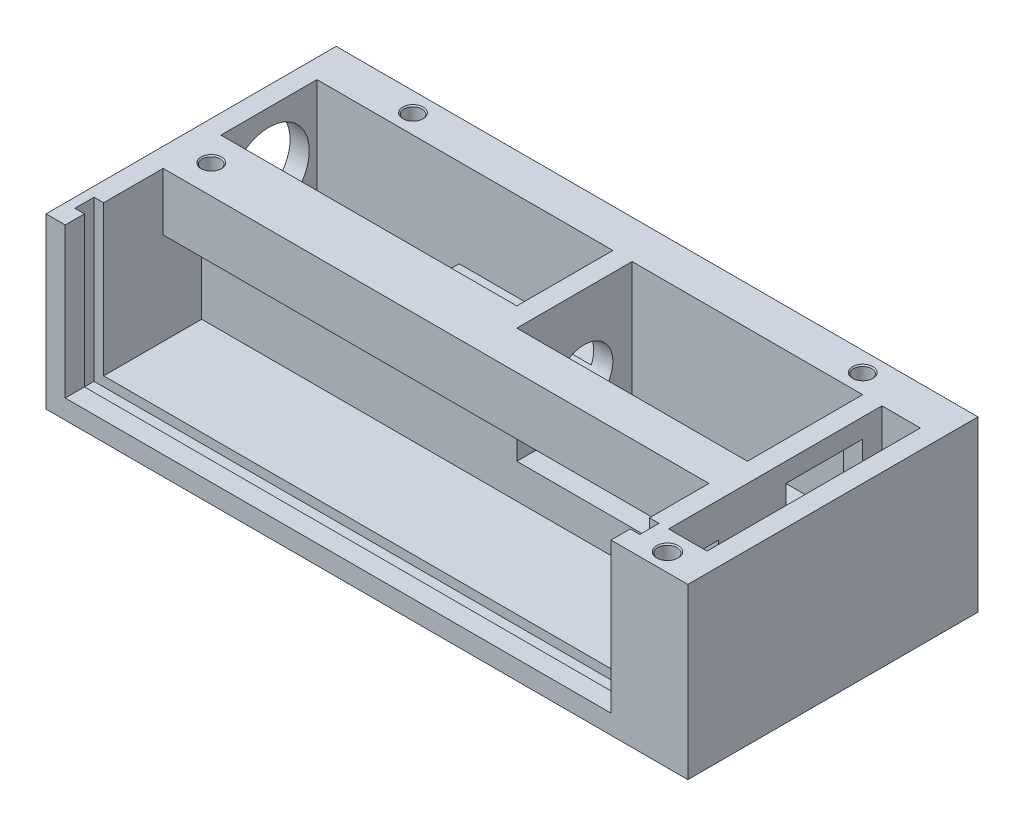
from build123d import *
from build123d.topology import SkipClean

# Parameters (mm, degrees)
SKETCH1_W           = 152
SKETCH1_H           = 65.5
BOSS_EXTRUDE1_DEPTH = 44
SKETCH2_W           = 142
SKETCH2_H           = 25.5
CUT_EXTRUDE1_DEPTH  = 39
SKETCH4_W           = 60
SKETCH4_H           = 30
CUT_EXTRUDE2_DEPTH  = 30
BOSS_EXTRUDE3_REACH = 158.9
SKETCH5_W           = 10
SKETCH5_H           = 15
SKETCH9_W           = 152
SKETCH9_H           = 44
BOSS_EXTRUDE4_DEPTH = 10
CUT_EXTRUDE5_DEPTH  = 41.5
SKETCH11_W          = 142
SKETCH11_H          = 39
CUT_EXTRUDE6_DEPTH  = 5
SKETCH16_W          = 77
SKETCH16_H          = 25
CUT_EXTRUDE8_DEPTH  = 39
SKETCH17_R          = 10.5
CUT_EXTRUDE9_DEPTH  = 5
SKETCH18_R          = 7.5
CUT_EXTRUDE10_DEPTH = 5
SKETCH20_W          = 75.5
SKETCH20_H          = 44
BOSS_EXTRUDE6_DEPTH = 15
SKETCH21_W          = 10
SKETCH21_H          = 55.5
CUT_EXTRUDE12_DEPTH = 39
SKETCH22_W          = 20
SKETCH22_H          = 20
SKETCH22_W_2        = 7.5
SKETCH22_H_2        = 25
CUT_EXTRUDE13_DEPTH = 5
CUT_EXTRUDE14_DEPTH = 3.5
SKETCH24_W          = 5
SKETCH24_H          = 6.5
BOSS_EXTRUDE7_DEPTH = 5
SKETCH24_3_W        = 3
SKETCH24_3_H        = 12
BOSS_EXTRUDE8_DEPTH = 2.5
CUT_EXTRUDE7_DEPTH  = 6
BOSS_EXTRUDE5_DEPTH = 3
SKETCH19_R          = 2.35
SKETCH19_R_2        = 2.5
CUT_EXTRUDE11_DEPTH = 6
BOSS_EXTRUDE9_DEPTH = 40
CHAMFER1_SIZE       = 0.3


with BuildPart() as part:
    # Sketch1 → Boss-Extrude1 (new body)
    with BuildSketch(Plane(origin=(0, 0, 0), x_dir=(1, 0, 0), z_dir=(0, 1, 0))):
        Rectangle(SKETCH1_W, SKETCH1_H)
    extrude(amount=BOSS_EXTRUDE1_DEPTH)

    # Sketch2 → Cut-Extrude1 (cut)
    with BuildSketch(Plane(origin=(0, 44, 0), x_dir=(1, 0, 0), z_dir=(0, 1, 0))):
        with Locations((0, -20)):
            Rectangle(SKETCH2_W, SKETCH2_H)
    extrude(amount=-CUT_EXTRUDE1_DEPTH, mode=Mode.SUBTRACT)

    # Sketch4 → Cut-Extrude2 (cut)
    with BuildSketch(Plane(origin=(0, 44, 0), x_dir=(1, 0, 0), z_dir=(0, 1, 0))):
        with Locations((41, 7.75)):
            Rectangle(SKETCH4_W, SKETCH4_H)
    extrude(amount=-CUT_EXTRUDE2_DEPTH, mode=Mode.SUBTRACT)

    # Boss-Extrude3: up to this face of the body (flat: up to its plane)
    boss_extrude3_end = Plane(part.part.faces().sort_by_distance((71, 26.637767221, 6.817102138))[0])
    # Sketch5 → Boss-Extrude3 (add, up to the picked face)
    with BuildSketch(Plane(origin=(-71, 0, 0), x_dir=(0, 0, -1), z_dir=(1, 0, 0)), mode=Mode.PRIVATE) as boss_extrude3_sk1:
        with Locations((-12.25, 36.5)):
            Rectangle(SKETCH5_W, SKETCH5_H)
    boss_extrude3_tool1 = split(extrude(boss_extrude3_sk1.sketch, amount=BOSS_EXTRUDE3_REACH, mode=Mode.PRIVATE), bisect_by=boss_extrude3_end, keep=Keep.BOTH, mode=Mode.PRIVATE)
    add(boss_extrude3_tool1.solids().sort_by(Axis((-71, 36.5, 12.25), (1, 0, 0)))[0])

    # Sketch9 → Boss-Extrude4 (add)
    with BuildSketch(Plane.XY.offset(32.75)):
        with Locations((0, 22)):
            Rectangle(SKETCH9_W, SKETCH9_H)
    extrude(amount=BOSS_EXTRUDE4_DEPTH)

    # Sketch10 → Cut-Extrude5 (cut)
    with BuildSketch(Plane(origin=(0, 44, 0), x_dir=(1, 0, 0), z_dir=(0, 1, 0))):
        Polygon((-73.5, -32.75), (-73.5, -37.75), (73.5, -37.75), (73.5, -32.75), (71, -32.75), (-71, -32.75), align=None)
    extrude(amount=-CUT_EXTRUDE5_DEPTH, mode=Mode.SUBTRACT)

    # Sketch11 → Cut-Extrude6 (cut)
    with BuildSketch(Plane.XY.offset(42.75)):
        with Locations((0, 24.5)):
            Rectangle(SKETCH11_W, SKETCH11_H)
    extrude(amount=-CUT_EXTRUDE6_DEPTH, mode=Mode.SUBTRACT)

    # Sketch16 → Cut-Extrude8 (cut)
    with BuildSketch(Plane(origin=(0, 44, 0), x_dir=(1, 0, 0), z_dir=(0, 1, 0))):
        with Locations((-32.5, 10.25)):
            Rectangle(SKETCH16_W, SKETCH16_H)
    extrude(amount=-CUT_EXTRUDE8_DEPTH, mode=Mode.SUBTRACT)

    # Sketch17 → Cut-Extrude9 (cut)
    with BuildSketch(Plane(origin=(-71, 0, 0), x_dir=(0, 0, -1), z_dir=(1, 0, 0))):
        with Locations((10.25, 29)):
            Circle(SKETCH17_R)
        with BuildLine():
            Line((7.5, 12), (13, 12))
            ThreePointArc((13, 12), (15, 10), (13, 8))
            Line((13, 8), (7.5, 8))
            ThreePointArc((7.5, 8), (5.5, 10), (7.5, 12))
        make_face()
    extrude(amount=-CUT_EXTRUDE9_DEPTH, mode=Mode.SUBTRACT)

    # Sketch18 → Cut-Extrude10 (cut)
    with BuildSketch(Plane(origin=(11, 0, 0), x_dir=(0, 0, -1), z_dir=(1, 0, 0))):
        with Locations((10.25, 24)):
            Circle(SKETCH18_R)
    extrude(amount=-CUT_EXTRUDE10_DEPTH, mode=Mode.SUBTRACT)

    # Sketch20 → Boss-Extrude6 (add)
    with BuildSketch(Plane(origin=(76, 0, 0), x_dir=(0, 0, -1), z_dir=(1, 0, 0))):
        with Locations((-5, 22)):
            Rectangle(SKETCH20_W, SKETCH20_H)
    extrude(amount=BOSS_EXTRUDE6_DEPTH)

    # Sketch21 → Cut-Extrude12 (cut)
    with BuildSketch(Plane(origin=(0, 44, 0), x_dir=(1, 0, 0), z_dir=(0, 1, 0))):
        with Locations((81, -5)):
            Rectangle(SKETCH21_W, SKETCH21_H)
    extrude(amount=-CUT_EXTRUDE12_DEPTH, mode=Mode.SUBTRACT)

    # Sketch22 → Cut-Extrude13 (cut)
    with BuildSketch(Plane(origin=(76, 0, 0), x_dir=(0, 0, -1), z_dir=(1, 0, 0))):
        with Locations((7.75, 29)):
            Rectangle(SKETCH22_W, SKETCH22_H)
        with Locations((-23.5, 22.5)):
            Rectangle(SKETCH22_W_2, SKETCH22_H_2)
    extrude(amount=-CUT_EXTRUDE13_DEPTH, mode=Mode.SUBTRACT)

    # Sketch23 → Cut-Extrude14 (cut)
    with BuildSketch(Plane(origin=(-71, 0, 0), x_dir=(0, 0, -1), z_dir=(1, 0, 0))):
        with BuildLine():
            ThreePointArc((7.5, 8), (5.5, 10), (7.5, 12))
            Line((7.5, 12), (4.25, 12))
            Line((4.25, 12), (4.25, 5))
            Line((4.25, 5), (16.25, 5))
            Line((16.25, 5), (16.25, 12))
            Line((16.25, 12), (13, 12))
            ThreePointArc((13, 12), (15, 10), (13, 8))
            Line((13, 8), (7.5, 8))
        make_face()
    extrude(amount=-CUT_EXTRUDE14_DEPTH, mode=Mode.SUBTRACT)

    # Sketch24 → Boss-Extrude7 (add)
    with BuildSketch(Plane(origin=(0, 5, 0), x_dir=(1, 0, 0), z_dir=(0, 1, 0))):
        with Locations((-68.5, 1)):
            Rectangle(SKETCH24_W, SKETCH24_H)
        with Locations((-68.5, 19.5)):
            Rectangle(SKETCH24_W, SKETCH24_H)
        Polygon((-45, -2.25), (-45, 4.25), (-48, 4.25), (-50, 4.25), (-50, -2.25), align=None)
        Polygon((-45, 22.75), (-50, 22.75), (-50, 16.25), (-48, 16.25), (-45, 16.25), align=None)
    extrude(amount=BOSS_EXTRUDE7_DEPTH)

    # Sketch24<3> → Boss-Extrude8 (add)
    with BuildSketch(Plane(origin=(0, 5, 0), x_dir=(1, 0, 0), z_dir=(0, 1, 0))):
        with Locations((-46.5, 10.25)):
            Rectangle(SKETCH24_3_W, SKETCH24_3_H)
    extrude(amount=BOSS_EXTRUDE8_DEPTH)

    # Sketch13 → Cut-Extrude7 (cut)
    with BuildSketch(Plane(origin=(0, 0, -32.75), x_dir=(-1, 0, 0), z_dir=(0, 0, -1))):
        with BuildLine():
            Line((-86, 34), (-86, 24))
            ThreePointArc((-86, 24), (-81, 19), (-76, 24))
            Line((-76, 24), (-76, 34))
            ThreePointArc((-76, 34), (-81, 39), (-86, 34))
        make_face()
        with BuildLine():
            Line((61, 34), (61, 24))
            ThreePointArc((61, 24), (66, 19), (71, 24))
            Line((71, 24), (71, 34))
            ThreePointArc((71, 34), (66, 39), (61, 34))
        make_face()
    extrude(amount=-CUT_EXTRUDE7_DEPTH, mode=Mode.SUBTRACT)

    # Sketch15 → Boss-Extrude5 (add)
    with SkipClean():  # the faces are left unmerged after this step: merging them gives an invalid solid
        with BuildSketch(Plane(origin=(0, 0, -32.75), x_dir=(-1, 0, 0), z_dir=(0, 0, -1))):
            with BuildLine():
                ThreePointArc((-76, 34), (-81, 39), (-86, 34))
                Line((-86, 34), (-86, 24))
                ThreePointArc((-86, 24), (-85.183300133, 26.738612788), (-83, 28.582575695))
                Line((-83, 28.582575695), (-83, 34))
                Line((-83, 34), (-79, 34))
                Line((-79, 34), (-79, 28.582575695))
                ThreePointArc((-79, 28.582575695), (-76.816699867, 26.738612788), (-76, 24))
                Line((-76, 24), (-76, 34))
            make_face()
            with BuildLine():
                ThreePointArc((71, 34), (66, 39), (61, 34))
                Line((61, 34), (61, 24))
                ThreePointArc((61, 24), (61.816699867, 26.738612788), (64, 28.582575695))
                Line((64, 28.582575695), (64, 34))
                Line((64, 34), (68, 34))
                Line((68, 34), (68, 28.582575695))
                ThreePointArc((68, 28.582575695), (70.183300133, 26.738612788), (71, 24))
                Line((71, 24), (71, 34))
            make_face()
        extrude(amount=-BOSS_EXTRUDE5_DEPTH)

    # Sketch19 → Cut-Extrude11 (cut)
    with SkipClean():  # the faces are left unmerged after this step: merging them gives an invalid solid
        with BuildSketch(Plane(origin=(0, 44, 0), x_dir=(1, 0, 0), z_dir=(0, 1, 0))):
            with Locations(Location((-66, -9.75, 0), (0, 0, 270))):
                Circle(SKETCH19_R)
            with Locations(Location((-51, 27.75, 0), (0, 0, 270))):
                Circle(SKETCH19_R)
            with Locations(Location((66, 27.75, 0), (0, 0, 270))):
                Circle(SKETCH19_R)
            with Locations(Location((81, -38.05, 0), (0, 0, 270))):
                Circle(SKETCH19_R_2)
        extrude(amount=-CUT_EXTRUDE11_DEPTH, mode=Mode.SUBTRACT)

    # Sketch25 → Boss-Extrude9 (add)
    with SkipClean():  # the faces are left unmerged after this step: merging them gives an invalid solid
        with BuildSketch(Plane.ZY.offset(-6)):
            with BuildLine():
                Line((-22.75, 21), (-22.75, 18.5))
                Line((-22.75, 18.5), (-16.25, 18.5))
                Line((-16.25, 18.5), (-16.25, 19.5))
                ThreePointArc((-16.25, 19.5), (-16.730477654, 20.224631227), (-17.123863542, 21))
                Line((-17.123863542, 21), (-22.75, 21))
            make_face()
            with BuildLine():
                Line((-4.25, 18.5), (2.25, 18.5))
                Line((2.25, 18.5), (2.25, 21))
                Line((2.25, 21), (-3.376136458, 21))
                ThreePointArc((-3.376136458, 21), (-3.769522346, 20.224631227), (-4.25, 19.5))
                Line((-4.25, 19.5), (-4.25, 18.5))
            make_face()
        extrude(amount=BOSS_EXTRUDE9_DEPTH)

    # Chamfer1
    chamfer1_edges = [part.edges().sort_by_distance(p)[0] for p in [
        (-66, 44, 7.4),
        (-51, 44, -30.1),
        (66, 44, -30.1),
        (81, 44, 35.55),
    ]]
    chamfer(chamfer1_edges, length=CHAMFER1_SIZE)


solid = part.part
